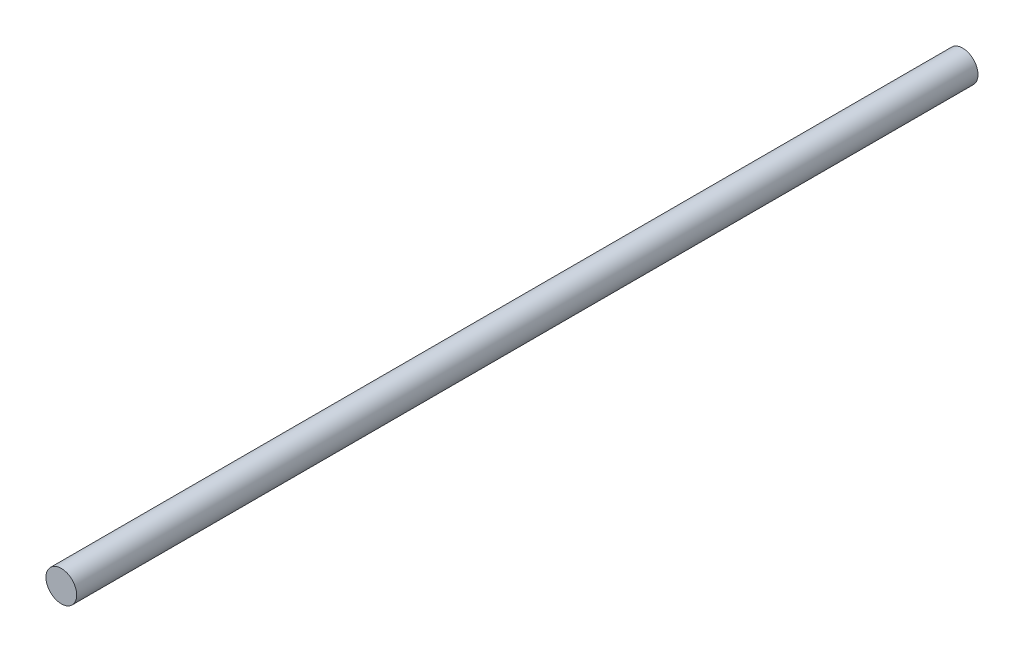
from build123d import *

# Parameters (mm, degrees)
SKETCH_1_R      = 1.5
EXTRUDE_1_DEPTH = 88


with BuildPart() as part:
    # 草圖1 → 填料-伸長1 (new body)
    with BuildSketch(Plane.XY):
        Circle(SKETCH_1_R)
    extrude(amount=EXTRUDE_1_DEPTH)


solid = part.part
